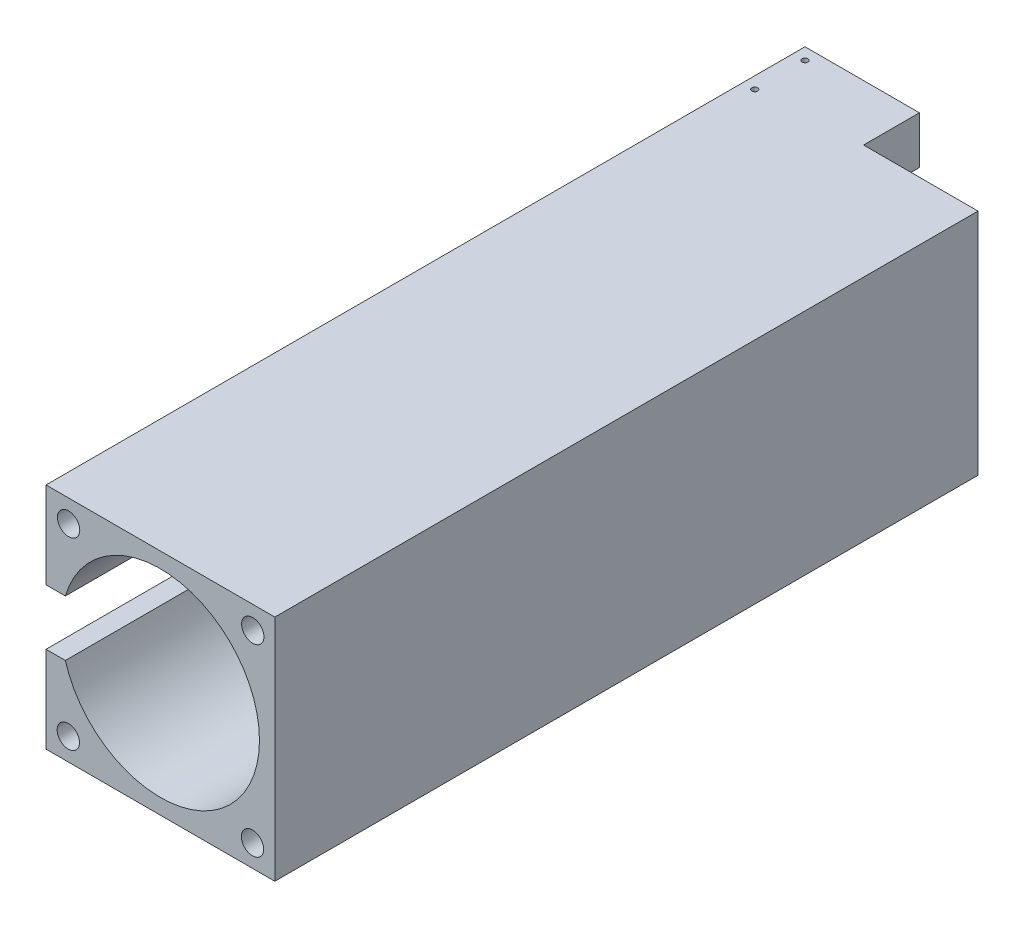
from build123d import *

# Parameters (mm, degrees)
SKETCH_1_W          = 82
SKETCH_1_H          = 82
SKETCH_1_R          = 35.5
EXTRUDE_1_DEPTH     = 245
SKETCH_2_W          = 82
SKETCH_2_H          = 82
EXTRUDE_2_DEPTH     = 27
SKETCH_3_W          = 8
SKETCH_3_H          = 20
CUT_EXTRUDE_1_DEPTH = 245
SKETCH_4_R          = 4
CUT_EXTRUDE_2_DEPTH = 20
FILLET_2_R          = 3
FILLET_3_R          = 3
FILLET_4_R          = 3
FILLET_5_R          = 3
SKETCH_5_R          = 1.05
CUT_EXTRUDE_3_DEPTH = 10
EXTRUDE_START       = 0.2
SKETCH_6_R          = 1.05
EXTRUDE_3_DEPTH     = 0.2
CUT_EXTRUDE_5_REACH = 263.591
SKETCH_7_W          = 20
SKETCH_7_H          = 65
CUT_EXTRUDE_6_REACH = 263.591
SKETCH_8_W          = 41
SKETCH_8_H          = 20
SKETCH_9_R          = 1.2
CUT_EXTRUDE_7_DEPTH = 10


with BuildPart() as part:
    # 草圖1 → 填料-伸長1 (new body)
    with BuildSketch(Plane.XY):
        Rectangle(SKETCH_1_W, SKETCH_1_H)
        Circle(SKETCH_1_R, mode=Mode.SUBTRACT)
    extrude(amount=EXTRUDE_1_DEPTH)

    # 草圖2 → 填料-伸長2 (add)
    with BuildSketch(Plane(origin=(0, 0, 0), x_dir=(-1, 0, 0), z_dir=(0, 0, -1))):
        Rectangle(SKETCH_2_W, SKETCH_2_H)
    extrude(amount=EXTRUDE_2_DEPTH)

    # 草圖3 → 除料-伸長1 (cut)
    with BuildSketch(Plane.XY.offset(245)):
        with Locations((-37, 0)):
            Rectangle(SKETCH_3_W, SKETCH_3_H)
    extrude(amount=-CUT_EXTRUDE_1_DEPTH, mode=Mode.SUBTRACT)

    # 草圖4 → 除料-伸長2 (cut)
    with BuildSketch(Plane.XY.offset(245)):
        with Locations((-32.9, 33)):
            Circle(SKETCH_4_R)
        with Locations((33.1, 32.9)):
            Circle(SKETCH_4_R)
        with Locations((33, -33.1)):
            Circle(SKETCH_4_R)
        with Locations((-33, -33)):
            Circle(SKETCH_4_R)
    extrude(amount=-CUT_EXTRUDE_2_DEPTH, mode=Mode.SUBTRACT)

    # 圓角2
    fillet_2_edges = [part.edges().sort_by_distance(p)[0] for p in [
        (-36.9, 33, 225),
    ]]
    fillet(fillet_2_edges, radius=FILLET_2_R)

    # 圓角3
    fillet_3_edges = [part.edges().sort_by_distance(p)[0] for p in [
        (29.1, 32.9, 225),
    ]]
    fillet(fillet_3_edges, radius=FILLET_3_R)

    # 圓角4
    fillet_4_edges = [part.edges().sort_by_distance(p)[0] for p in [
        (-37, -33, 225),
    ]]
    fillet(fillet_4_edges, radius=FILLET_4_R)

    # 圓角5
    fillet_5_edges = [part.edges().sort_by_distance(p)[0] for p in [
        (29, -33.1, 225),
    ]]
    fillet(fillet_5_edges, radius=FILLET_5_R)

    # 草圖5 → 除料-伸長3 (cut)
    with BuildSketch(Plane(origin=(0, 41, 0), x_dir=(1, 0, 0), z_dir=(0, 1, 0))):
        with Locations(Location((-36.75, 22.75, 0), (0, 0, 270))):
            Circle(SKETCH_5_R)
        with Locations(Location((-36.75, 4.75, 0), (0, 0, 270))):
            Circle(SKETCH_5_R)
    extrude(amount=-CUT_EXTRUDE_3_DEPTH, mode=Mode.SUBTRACT)

    # 草圖6 → 填料-伸長3 (add)
    with BuildSketch(Plane(origin=(0, 35, 0), x_dir=(1, 0, 0), z_dir=(0, 1, 0)).offset(EXTRUDE_START)):
        with Locations(Location((-36.75, 22.75, 0), (0, 0, 270))):
            Circle(SKETCH_6_R)
        with Locations(Location((-36.75, 4.75, 0), (0, 0, 270))):
            Circle(SKETCH_6_R)
    extrude(amount=-EXTRUDE_3_DEPTH)

    # 草圖7 → 除料-伸長5 (cut, up to next)
    with BuildSketch(Plane(origin=(-41, 0, 0), x_dir=(0, 0, -1), z_dir=(1, 0, 0)), mode=Mode.PRIVATE) as cut_extrude_5_sk1:
        with Locations((17, -8.5)):
            Rectangle(SKETCH_7_W, SKETCH_7_H)
    cut_extrude_5_tool1 = extrude(cut_extrude_5_sk1.sketch, amount=CUT_EXTRUDE_5_REACH, mode=Mode.PRIVATE) & part.part
    add(cut_extrude_5_tool1.solids().sort_by_distance((-41, -8.5, -17))[0], mode=Mode.SUBTRACT)

    # 草圖8 → 除料-伸長6 (cut, up to next)
    with BuildSketch(Plane(origin=(0, 41, 0), x_dir=(1, 0, 0), z_dir=(0, 1, 0)), mode=Mode.PRIVATE) as cut_extrude_6_sk1:
        with Locations((20.5, 17)):
            Rectangle(SKETCH_8_W, SKETCH_8_H)
    cut_extrude_6_tool1 = extrude(cut_extrude_6_sk1.sketch, amount=-CUT_EXTRUDE_6_REACH, mode=Mode.PRIVATE) & part.part
    add(cut_extrude_6_tool1.solids().sort_by_distance((20.5, 41, -17))[0], mode=Mode.SUBTRACT)

    # 草圖9 → 除料-伸長7 (cut)
    with BuildSketch(Plane(origin=(0, 0, -7), x_dir=(-1, 0, 0), z_dir=(0, 0, -1))):
        with Locations((-33, 33)):
            Circle(SKETCH_9_R)
        with Locations((-33, -33)):
            Circle(SKETCH_9_R)
        with Locations((33, -33)):
            Circle(SKETCH_9_R)
        with Locations((38, 20)):
            Circle(SKETCH_9_R)
    extrude(amount=-CUT_EXTRUDE_7_DEPTH, mode=Mode.SUBTRACT)


solid = part.part
